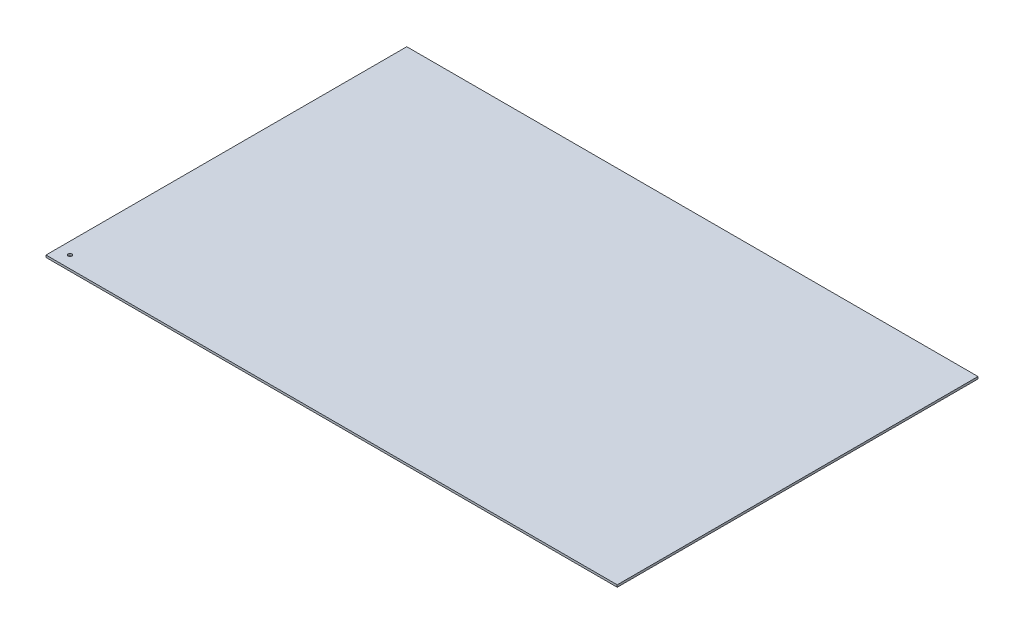
from build123d import *

# Parameters (mm, degrees)
SKETCH1_W           = 603.25
SKETCH1_H           = 381
BOSS_EXTRUDE1_DEPTH = 2.286
SKETCH2_R           = 2.032
CUT_EXTRUDE1_DEPTH  = 22.86


with BuildPart() as part:
    # Sketch1 → Boss-Extrude1 (new body)
    with BuildSketch(Plane(origin=(0, 0, 0), x_dir=(1, 0, 0), z_dir=(0, 1, 0))):
        with Locations((301.625, 190.5)):
            Rectangle(SKETCH1_W, SKETCH1_H)
    extrude(amount=BOSS_EXTRUDE1_DEPTH)

    # Sketch2 → Cut-Extrude1 (cut)
    with BuildSketch(Plane(origin=(0, 2.286, 0), x_dir=(1, 0, 0), z_dir=(0, 1, 0))):
        with Locations(Location((12.7, 12.7, 0), (0, 0, 270))):
            Circle(SKETCH2_R)
    extrude(amount=-CUT_EXTRUDE1_DEPTH, mode=Mode.SUBTRACT)


solid = part.part
